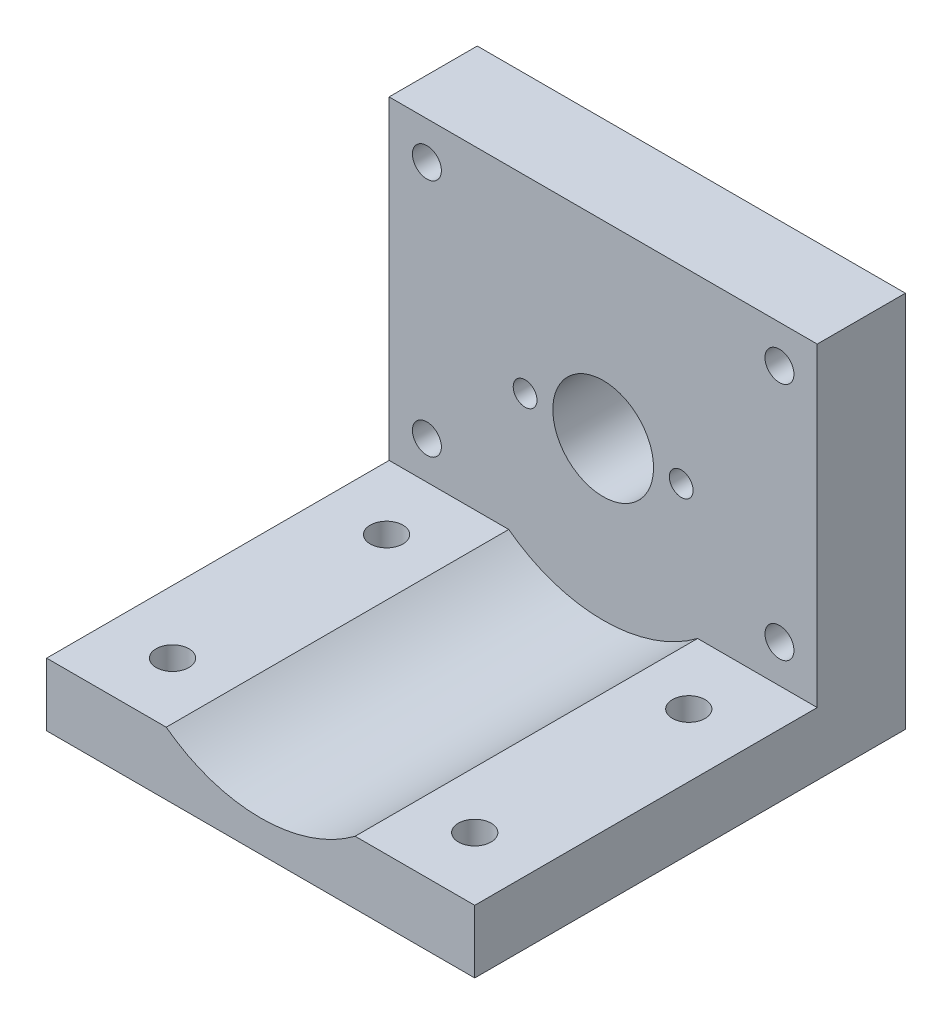
from build123d import *

# Parameters (mm, degrees)
SKETCH2_W                                       = 43.18
SKETCH2_H                                       = 38.1
SKETCH2_R                                       = 5.08
SKETCH2_R_2                                     = 1.4605
BOSS_EXTRUDE1_DEPTH                             = 8.89
CSK_FOR_M2_FLAT_HEAD_MACHINE_SCREW4_D           = 2.4
CSK_FOR_M2_FLAT_HEAD_MACHINE_SCREW4_CSINK_D     = 4.4
CSK_FOR_M2_FLAT_HEAD_MACHINE_SCREW4_CSINK_ANGLE = 90
BOSS_EXTRUDE4_DEPTH                             = 34.544
SKETCH17_R                                      = 1.651
CUT_EXTRUDE1_DEPTH                              = 34.544
CUT_EXTRUDE2_DEPTH                              = 1.27


with BuildPart() as part:
    # Sketch2 → Boss-Extrude1 (new body)
    with BuildSketch(Plane.XY):
        Rectangle(SKETCH2_W, SKETCH2_H)
        Circle(SKETCH2_R, mode=Mode.SUBTRACT)
        with Locations((-17.78, 15.24)):
            Circle(SKETCH2_R_2, mode=Mode.SUBTRACT)
        with Locations((17.78, 15.24)):
            Circle(SKETCH2_R_2, mode=Mode.SUBTRACT)
        with Locations((17.78, -8.89)):
            Circle(SKETCH2_R_2, mode=Mode.SUBTRACT)
        with Locations((-17.78, -8.89)):
            Circle(SKETCH2_R_2, mode=Mode.SUBTRACT)
    extrude(amount=BOSS_EXTRUDE1_DEPTH)

    # CSK for M2 Flat Head Machine Screw4 (through all)
    with Locations(Plane(origin=(0, 0, 0), x_dir=(1, 0, 0), z_dir=(0, 0, -1))):
        with Locations((-7.874, 0), (7.874, 0)):
            CounterSinkHole(CSK_FOR_M2_FLAT_HEAD_MACHINE_SCREW4_D / 2, CSK_FOR_M2_FLAT_HEAD_MACHINE_SCREW4_CSINK_D / 2, counter_sink_angle=CSK_FOR_M2_FLAT_HEAD_MACHINE_SCREW4_CSINK_ANGLE)

    # Sketch13 → Boss-Extrude4 (add)
    with BuildSketch(Plane.XY.offset(8.89)):
        with BuildLine():
            Line((-21.59, -12.7), (-21.59, -19.05))
            Line((-21.59, -19.05), (21.59, -19.05))
            Line((21.59, -19.05), (21.59, -12.7))
            Line((21.59, -12.7), (9.525, -12.7))
            ThreePointArc((9.525, -12.7), (0, -15.875), (-9.525, -12.7))
            Line((-9.525, -12.7), (-21.59, -12.7))
        make_face()
    extrude(amount=BOSS_EXTRUDE4_DEPTH)

    # Sketch17 → Cut-Extrude1 (cut)
    with BuildSketch(Plane(origin=(0, 0, 0), x_dir=(1, 0, 0), z_dir=(0, 1, 0))):
        with Locations(Location((-15.24, -15.494, 0), (0, 0, 270))):
            Circle(SKETCH17_R)
        with Locations(Location((15.24, -15.494, 0), (0, 0, 270))):
            Circle(SKETCH17_R)
        with Locations(Location((-15.24, -37.084, 0), (0, 0, 270))):
            Circle(SKETCH17_R)
        with Locations(Location((15.24, -37.084, 0), (0, 0, 270))):
            Circle(SKETCH17_R)
    extrude(amount=-CUT_EXTRUDE1_DEPTH, mode=Mode.SUBTRACT)

    # Sketch18 → Cut-Extrude2 (cut)
    # profile 1 of 7: a face of its own
    with BuildSketch(Plane(origin=(0, 0, 0), x_dir=(-1, 0, 0), z_dir=(0, 0, -1))):
        Polygon((-9.576939513, 11.26967481), (-7.867324128, 11.26967481), (-7.867324128, 10.699803015), (-9.007067718, 10.699803015), (-9.007067718, 10.089226092), (-7.867324128, 10.089226092), (-7.867324128, 9.519354297), (-9.007067718, 9.519354297), (-9.007067718, 8.664546605), (-7.867324128, 8.664546605), (-7.867324128, 8.09467481), (-9.576939513, 8.09467481), align=None)
    # profile 2 of 7: a face of its own
    with BuildSketch(Plane(origin=(0, 0, 0), x_dir=(-1, 0, 0), z_dir=(0, 0, -1))):
        Polygon((-7.643445923, 10.414867118), (-7.063397846, 10.414867118), (-6.462997205, 9.045521164), (-5.864504617, 10.414867118), (-5.282548487, 10.414867118), (-6.298268639, 8.09467481), (-6.627089753, 8.09467481), align=None)
    # profile 3 of 7: a face of its own
    with BuildSketch(Plane(origin=(0, 0, 0), x_dir=(-1, 0, 0), z_dir=(0, 0, -1))):
        with BuildLine():
            Line((-3.186234385, 10.414867118), (-2.61636259, 10.414867118))
            Line((-2.61636259, 10.414867118), (-2.61636259, 8.09467481))
            Line((-2.61636259, 8.09467481), (-3.186234385, 8.09467481))
            Line((-3.186234385, 8.09467481), (-3.186234385, 8.347809826))
            add(Edge.make_bspline(
                [(-3.186234385, 8.347809826), (-3.214471322, 8.323169934), (-3.269273641, 8.275348769), (-3.355624364, 8.213299592), (-3.442227413, 8.16211704), (-3.529498919, 8.121352929), (-3.618780208, 8.091252828), (-3.71071407, 8.069459652), (-3.80662445, 8.056607683), (-3.871823005, 8.054858175), (-3.904934304, 8.053969682)],
                knots=[0, 0, 0, 0, 1.129196829, 2.191548051, 3.199897424, 4.157751732, 5.089409408, 6.034969131, 7.002052659, 8, 8, 8, 8], degree=3))
            add(Edge.make_bspline(
                [(-3.904934304, 8.053969682), (-3.94210321, 8.054805866), (-4.015551072, 8.056458213), (-4.123327657, 8.073851834), (-4.227396665, 8.100476646), (-4.32767362, 8.138154084), (-4.423976078, 8.186976656), (-4.517041044, 8.245670515), (-4.605273102, 8.316296165), (-4.689406753, 8.395797814), (-4.766439019, 8.483250194), (-4.833781353, 8.577439478), (-4.890545936, 8.677029798), (-4.937050121, 8.781690967), (-4.973631668, 8.891346169), (-4.999709077, 9.006343198), (-5.015094778, 9.126723124), (-5.016999094, 9.208721215), (-5.017965154, 9.250318841)],
                knots=[0, 0, 0, 0, 0.980476535, 1.937477201, 2.874147792, 3.812856188, 4.758993464, 5.720109578, 6.712210464, 7.737600662, 8.772720504, 9.783789959, 10.789002326, 11.793715968, 12.802552247, 13.835794126, 14.902098527, 16, 16, 16, 16], degree=3))
            add(Edge.make_bspline(
                [(-5.017965154, 9.250318841), (-5.016951271, 9.293393237), (-5.014962426, 9.377888463), (-5.000414147, 9.501881191), (-4.974817965, 9.619729562), (-4.93991573, 9.731596812), (-4.895020066, 9.837502268), (-4.840340147, 9.937619437), (-4.775132104, 10.03168663), (-4.699991394, 10.118102755), (-4.618857883, 10.197307308), (-4.532059369, 10.266261152), (-4.440953191, 10.324840651), (-4.345442533, 10.372664255), (-4.245541035, 10.409619916), (-4.141643106, 10.436637522), (-4.033287512, 10.452849035), (-3.959474803, 10.45465697), (-3.92210678, 10.455572246)],
                knots=[0, 0, 0, 0, 1.136281865, 2.228943489, 3.287578264, 4.313574083, 5.316051562, 6.317280042, 7.318008486, 8.329309503, 9.333984563, 10.305318864, 11.248632312, 12.186624717, 13.117503092, 14.05354244, 15.014596925, 16, 16, 16, 16], degree=3))
            add(Edge.make_bspline(
                [(-3.92210678, 10.455572246), (-3.887491883, 10.454853114), (-3.819001479, 10.453430212), (-3.718330454, 10.437980214), (-3.620694078, 10.41461319), (-3.526624965, 10.381319386), (-3.435351527, 10.339279185), (-3.348443726, 10.286599679), (-3.264000374, 10.225494966), (-3.212476653, 10.17777089), (-3.186234385, 10.153463873)],
                knots=[0, 0, 0, 0, 1.017011718, 2.012299608, 2.98747302, 3.965332399, 4.941441765, 5.936729654, 6.94912688, 8, 8, 8, 8], degree=3))
            Line((-3.186234385, 10.153463873), (-3.186234385, 10.414867118))
        make_face()
        with BuildLine():
            add(Edge.make_bspline(
                [(-3.802535466, 9.92640558), (-3.825243177, 9.925708829), (-3.869748809, 9.924343242), (-3.93520043, 9.916129145), (-3.997752545, 9.901655539), (-4.056959038, 9.880273895), (-4.113702302, 9.854227937), (-4.167120682, 9.821605803), (-4.217655056, 9.783047134), (-4.265008227, 9.739485435), (-4.308177619, 9.691603163), (-4.345392154, 9.63935323), (-4.377018497, 9.584143475), (-4.403766164, 9.5258079), (-4.422911424, 9.463656217), (-4.438074463, 9.398497528), (-4.445943098, 9.329799522), (-4.447369434, 9.282983957), (-4.448093359, 9.259223088)],
                knots=[0, 0, 0, 0, 1.04836806, 2.054732945, 3.03993516, 4.00574415, 4.955904794, 5.917688631, 6.888591924, 7.88601754, 8.884115178, 9.859153345, 10.841239365, 11.818093293, 12.814750328, 13.83810466, 14.90274714, 16, 16, 16, 16], degree=3))
            add(Edge.make_bspline(
                [(-4.448093359, 9.259223088), (-4.447380492, 9.235246693), (-4.445975795, 9.188001487), (-4.437947235, 9.118723988), (-4.423329825, 9.052613484), (-4.402003575, 8.990204434), (-4.375959277, 8.930654732), (-4.34425751, 8.874239207), (-4.305317441, 8.821955355), (-4.262110207, 8.772565965), (-4.213785593, 8.728463156), (-4.162965275, 8.689303911), (-4.108955086, 8.656539396), (-4.052341, 8.630058907), (-3.993313582, 8.608479535), (-3.931132806, 8.594187833), (-3.866407812, 8.585051419), (-3.822283075, 8.583779113), (-3.799991396, 8.583136349)],
                knots=[0, 0, 0, 0, 1.099136573, 2.165835871, 3.191374663, 4.196217796, 5.183857741, 6.167377911, 7.154730987, 8.166690795, 9.170734848, 10.148332609, 11.103258353, 12.059567475, 13.009337315, 13.978056681, 14.978520572, 16, 16, 16, 16], degree=3))
            add(Edge.make_bspline(
                [(-3.799991396, 8.583136349), (-3.776860727, 8.583837006), (-3.731512042, 8.585210675), (-3.66499261, 8.59334981), (-3.601600196, 8.607876484), (-3.541598545, 8.629380543), (-3.484071189, 8.655239543), (-3.42953726, 8.687224215), (-3.378588535, 8.725694402), (-3.330966982, 8.7696499), (-3.287331008, 8.81792316), (-3.249601825, 8.870858268), (-3.216738326, 8.926762214), (-3.190892696, 8.986956772), (-3.170367642, 9.050388817), (-3.155641389, 9.117452023), (-3.147631161, 9.188218692), (-3.14623875, 9.236519701), (-3.145529256, 9.26113114)],
                knots=[0, 0, 0, 0, 1.050008698, 2.058587853, 3.036635738, 3.995319155, 4.947022481, 5.895997462, 6.858296291, 7.838991643, 8.833936038, 9.806048392, 10.784806122, 11.771666913, 12.772873988, 13.80724452, 14.882696879, 16, 16, 16, 16], degree=3))
            add(Edge.make_bspline(
                [(-3.145529256, 9.26113114), (-3.146229934, 9.285319274), (-3.14759856, 9.332565727), (-3.155675935, 9.401854821), (-3.170506736, 9.467601212), (-3.190609351, 9.52992575), (-3.216914782, 9.588685931), (-3.249803147, 9.643230244), (-3.287118462, 9.695448447), (-3.331237549, 9.742417578), (-3.378601126, 9.786054805), (-3.430299135, 9.823361625), (-3.484702807, 9.855513679), (-3.5421464, 9.881911755), (-3.603161816, 9.901262545), (-3.666662564, 9.916245154), (-3.733639387, 9.924338312), (-3.779195338, 9.925705245), (-3.802535466, 9.92640558)],
                knots=[0, 0, 0, 0, 1.106611376, 2.161533483, 3.185006901, 4.184773755, 5.152708835, 6.122342771, 7.094156588, 8.082475533, 9.064254463, 10.03606828, 10.992420271, 11.951521816, 12.920622147, 13.915721683, 14.932141191, 16, 16, 16, 16], degree=3))
        make_face(mode=Mode.SUBTRACT)
    # profile 4 of 7: a face of its own
    with BuildSketch(Plane(origin=(0, 0, 0), x_dir=(-1, 0, 0), z_dir=(0, 0, -1))):
        with BuildLine():
            Line((-2.046490795, 10.414867118), (-1.476619, 10.414867118))
            Line((-1.476619, 10.414867118), (-1.476619, 10.169364314))
            add(Edge.make_bspline(
                [(-1.476619, 10.169364314), (-1.444108097, 10.194651964), (-1.38197344, 10.242981579), (-1.287518034, 10.304602085), (-1.198363826, 10.355035995), (-1.112523472, 10.393398607), (-1.028381884, 10.420998858), (-0.944576328, 10.440827991), (-0.859858771, 10.45352513), (-0.802908008, 10.45489024), (-0.774455538, 10.455572246)],
                knots=[0, 0, 0, 0, 1.276643801, 2.439914479, 3.493451431, 4.44993799, 5.350072675, 6.235028322, 7.118224225, 8, 8, 8, 8], degree=3))
            add(Edge.make_bspline(
                [(-0.774455538, 10.455572246), (-0.745594337, 10.454792855), (-0.688937374, 10.453262843), (-0.605513119, 10.442561655), (-0.525809345, 10.423071401), (-0.448929849, 10.397193616), (-0.375657132, 10.363036423), (-0.30509356, 10.322480299), (-0.238754812, 10.273080195), (-0.197900474, 10.235459448), (-0.177234986, 10.216429618)],
                knots=[0, 0, 0, 0, 1.048836932, 2.058954983, 3.049370783, 4.026390553, 5.001981509, 5.982488534, 6.97947532, 8, 8, 8, 8], degree=3))
            add(Edge.make_bspline(
                [(-0.177234986, 10.216429618), (-0.160660503, 10.19879453), (-0.127390233, 10.163395286), (-0.085523777, 10.102818113), (-0.04959765, 10.036777907), (-0.02016118, 9.964512872), (0.001591185, 9.88562596), (0.018325577, 9.80107001), (0.027715536, 9.710371572), (0.02887477, 9.648062601), (0.029470744, 9.616028977)],
                knots=[0, 0, 0, 0, 0.889584746, 1.785680191, 2.700364693, 3.65222533, 4.649950538, 5.707241244, 6.821271309, 8, 8, 8, 8], degree=3))
            Line((0.029470744, 9.616028977), (0.029470744, 8.09467481))
            Line((0.029470744, 8.09467481), (-0.540401051, 8.09467481))
            Line((-0.540401051, 8.09467481), (-0.540401051, 9.102126733))
            add(Edge.make_bspline(
                [(-0.540401051, 9.102126733), (-0.540521567, 9.13498806), (-0.540752512, 9.197960693), (-0.54252566, 9.288083995), (-0.545987878, 9.369477041), (-0.5491436, 9.442288023), (-0.555339536, 9.506258414), (-0.560927131, 9.561793194), (-0.569500755, 9.60838855), (-0.58065643, 9.658508846), (-0.600136985, 9.712171788), (-0.630379599, 9.768714563), (-0.668746595, 9.816748911), (-0.713670912, 9.856611577), (-0.765102935, 9.888146601), (-0.822421183, 9.910333456), (-0.885318362, 9.924160848), (-0.929144377, 9.925638298), (-0.951904457, 9.92640558)],
                knots=[0, 0, 0, 0, 1.49886392, 2.872294502, 4.110984203, 5.214877267, 6.195405875, 7.042225351, 7.75923308, 8.355011229, 9.382752534, 10.352059385, 11.267231453, 12.171456522, 13.078624015, 14.003401117, 14.963110155, 16, 16, 16, 16], degree=3))
            add(Edge.make_bspline(
                [(-0.951904457, 9.92640558), (-0.981504898, 9.924904533), (-1.039409115, 9.921968195), (-1.123155981, 9.899825525), (-1.200076083, 9.862167361), (-1.269540919, 9.810056035), (-1.330888894, 9.745718145), (-1.381416715, 9.668987831), (-1.422859908, 9.581716975), (-1.440681097, 9.517995074), (-1.44990626, 9.485009346)],
                knots=[0, 0, 0, 0, 0.984188326, 1.925263693, 2.85911992, 3.81709677, 4.80007086, 5.801799564, 6.862098548, 8, 8, 8, 8], degree=3))
            add(Edge.make_bspline(
                [(-1.44990626, 9.485009346), (-1.452199079, 9.474649956), (-1.457312527, 9.451546436), (-1.461517692, 9.412515563), (-1.467367381, 9.366209212), (-1.469559115, 9.311789367), (-1.473370301, 9.249513575), (-1.474779859, 9.179299447), (-1.47619194, 9.101284661), (-1.476471931, 9.046794297), (-1.476619, 9.018172406)],
                knots=[0, 0, 0, 0, 0.543362196, 1.211806945, 2.009705693, 2.934833164, 4.000995085, 5.207458376, 6.533175157, 8, 8, 8, 8], degree=3))
            Line((-1.476619, 9.018172406), (-1.476619, 8.09467481))
            Line((-1.476619, 8.09467481), (-2.046490795, 8.09467481))
            Line((-2.046490795, 8.09467481), (-2.046490795, 10.414867118))
        make_face()
    # profile 5 of 7: a face of its own
    with BuildSketch(Plane(origin=(0, 0, 0), x_dir=(-1, 0, 0), z_dir=(0, 0, -1))):
        Polygon((1.901906641, 11.26967481), (2.471778436, 11.26967481), (2.471778436, 10.048520964), (3.570816897, 10.048520964), (3.570816897, 11.26967481), (4.140688692, 11.26967481), (4.140688692, 8.09467481), (3.570816897, 8.09467481), (3.570816897, 9.478649169), (2.471778436, 9.478649169), (2.471778436, 8.09467481), (1.901906641, 8.09467481), align=None)
    # profile 6 of 7: a face of its own
    with BuildSketch(Plane(origin=(0, 0, 0), x_dir=(-1, 0, 0), z_dir=(0, 0, -1))):
        with BuildLine():
            add(Edge.make_bspline(
                [(5.897369381, 10.455572246), (5.92431182, 10.455092787), (5.977670056, 10.454143241), (6.057140483, 10.446239135), (6.135221583, 10.43334326), (6.212362157, 10.416645353), (6.287845882, 10.393249088), (6.362068662, 10.365188886), (6.435694141, 10.332972492), (6.506894951, 10.294623715), (6.576185464, 10.253030969), (6.641876994, 10.207150757), (6.703424018, 10.157343453), (6.761969058, 10.104763879), (6.814783822, 10.047122891), (6.865243455, 9.987197874), (6.910621748, 9.922841924), (6.95263551, 9.855623245), (6.99004006, 9.785930552), (7.022519032, 9.714248651), (7.050707727, 9.641568594), (7.07277891, 9.56700509), (7.091051815, 9.491541356), (7.102583317, 9.414252643), (7.110781415, 9.335932897), (7.111700682, 9.2832016), (7.112163051, 9.256679017)],
                knots=[0, 0, 0, 0, 1.022364134, 2.024744242, 3.027414945, 4.024939316, 5.017584196, 6.023349371, 7.035562955, 8.064994934, 9.090267829, 10.101425541, 11.102933353, 12.093946398, 13.084502048, 14.067315274, 15.065326281, 16.070028806, 17.074376865, 18.064572984, 19.055292013, 20.030201733, 21.013838017, 21.999348303, 22.993720005, 24, 24, 24, 24], degree=3))
            add(Edge.make_bspline(
                [(7.112163051, 9.256679017), (7.111675097, 9.229949227), (7.110704934, 9.176804344), (7.102879914, 9.097747905), (7.089934678, 9.020095738), (7.073172684, 8.943390382), (7.049863974, 8.868613354), (7.022630235, 8.794662412), (6.989199749, 8.722545536), (6.952239883, 8.651475997), (6.90995599, 8.583545155), (6.864616978, 8.518544513), (6.814368694, 8.458179344), (6.761976727, 8.400577554), (6.704956008, 8.34768698), (6.644216693, 8.298648819), (6.580284616, 8.252863558), (6.512700039, 8.211405405), (6.442328607, 8.174977604), (6.37035712, 8.142134969), (6.29636473, 8.11479113), (6.220504568, 8.092492983), (6.142730627, 8.075228085), (6.063214612, 8.063499835), (5.982127771, 8.055342972), (5.927494651, 8.054430392), (5.899913452, 8.053969682)],
                knots=[0, 0, 0, 0, 1.012026251, 2.012137606, 3.004615893, 3.992048833, 4.982446996, 5.968083444, 6.973977695, 7.990229942, 8.999482246, 10.001782172, 10.988562221, 11.971415814, 12.948383116, 13.930088534, 14.925840678, 15.924049238, 16.929462851, 17.924729459, 18.917889337, 19.913673841, 20.916777188, 21.931792057, 22.95587778, 24, 24, 24, 24], degree=3))
            add(Edge.make_bspline(
                [(5.899913452, 8.053969682), (5.859584115, 8.055153428), (5.780094377, 8.057486608), (5.663024787, 8.073468285), (5.550559556, 8.10097694), (5.442515424, 8.139323398), (5.338752038, 8.188462956), (5.240174963, 8.249280621), (5.145803625, 8.320579067), (5.057272607, 8.401755675), (4.976166201, 8.490813764), (4.905309998, 8.585882731), (4.845147347, 8.685537653), (4.795732377, 8.78989217), (4.757594097, 8.899089379), (4.730051752, 9.012802819), (4.714050536, 9.131352123), (4.711737088, 9.211897939), (4.710560487, 9.252862911)],
                knots=[0, 0, 0, 0, 1.029999031, 2.030143771, 3.011211297, 3.982305373, 4.953580601, 5.938004764, 6.935448627, 7.970290061, 9.001484052, 10.007591832, 10.993831261, 11.969999897, 12.951306496, 13.942897864, 14.953773953, 16, 16, 16, 16], degree=3))
            add(Edge.make_bspline(
                [(4.710560487, 9.252862911), (4.71177812, 9.296604521), (4.714171353, 9.38257778), (4.733174676, 9.508530563), (4.763520932, 9.629124384), (4.807081072, 9.744021903), (4.86272532, 9.853435034), (4.930654335, 9.957133011), (5.011203828, 10.055139325), (5.07288861, 10.114416903), (5.104255399, 10.144559626)],
                knots=[0, 0, 0, 0, 1.043912699, 2.05178951, 3.033892, 4.007821512, 4.978932272, 5.95884105, 6.962068106, 8, 8, 8, 8], degree=3))
            add(Edge.make_bspline(
                [(5.104255399, 10.144559626), (5.133037564, 10.169544553), (5.189818816, 10.218834642), (5.282069663, 10.281351038), (5.37652412, 10.335346132), (5.474314266, 10.379740142), (5.575712713, 10.413212509), (5.680199852, 10.437577398), (5.787753957, 10.452543026), (5.860645223, 10.454557375), (5.897369381, 10.455572246)],
                knots=[0, 0, 0, 0, 1.048115528, 2.067714963, 3.060638214, 4.039924844, 5.017819947, 5.994373833, 6.98952318, 8, 8, 8, 8], degree=3))
        make_face()
        with BuildLine():
            add(Edge.make_bspline(
                [(5.910089734, 9.92640558), (5.888025862, 9.92567225), (5.844592892, 9.924228681), (5.78065842, 9.916481437), (5.720188523, 9.900602795), (5.661982156, 9.880409508), (5.607068995, 9.853403831), (5.553945165, 9.821800966), (5.505372989, 9.782253869), (5.459001902, 9.738873598), (5.416907291, 9.69070097), (5.381038686, 9.638216928), (5.348989293, 9.583429401), (5.324687863, 9.524332551), (5.304576106, 9.462541664), (5.290964711, 9.397058388), (5.28149213, 9.328614208), (5.280788925, 9.281729476), (5.280432282, 9.257951052)],
                knots=[0, 0, 0, 0, 1.030650113, 2.02884584, 2.99876339, 3.944280128, 4.900564847, 5.851248946, 6.823638398, 7.81794922, 8.81432732, 9.802856497, 10.78262424, 11.771747962, 12.779760563, 13.812642396, 14.89064281, 16, 16, 16, 16], degree=3))
            add(Edge.make_bspline(
                [(5.280432282, 9.257951052), (5.280849603, 9.233334082), (5.281665176, 9.185224941), (5.290110605, 9.114979126), (5.304037396, 9.048316313), (5.323823002, 8.985339482), (5.348706742, 8.925596592), (5.379236205, 8.869422843), (5.415733596, 8.817155984), (5.457112779, 8.768860379), (5.502421217, 8.725021924), (5.552066662, 8.687401403), (5.603970148, 8.654714162), (5.659327814, 8.628461263), (5.717353423, 8.608191895), (5.778219228, 8.593268241), (5.84224508, 8.5852281), (5.885900592, 8.583843187), (5.908181681, 8.583136349)],
                knots=[0, 0, 0, 0, 1.141730614, 2.231293227, 3.276944405, 4.297399982, 5.28939179, 6.275415646, 7.257752684, 8.24146775, 9.222424823, 10.176631434, 11.126518621, 12.063689483, 13.012557477, 13.974037417, 14.965980454, 16, 16, 16, 16], degree=3))
            add(Edge.make_bspline(
                [(5.908181681, 8.583136349), (5.930473914, 8.583763282), (5.974179632, 8.584992436), (6.03828067, 8.594196854), (6.099457301, 8.608682794), (6.157978494, 8.629126614), (6.213371099, 8.655941442), (6.265847165, 8.688785062), (6.31586833, 8.726928851), (6.361784812, 8.771594455), (6.404288821, 8.820040676), (6.441562295, 8.872583448), (6.472709415, 8.928757212), (6.498255631, 8.988208522), (6.518080023, 9.050855663), (6.531776254, 9.116931487), (6.541253899, 9.186231219), (6.5419412, 9.233749194), (6.542291256, 9.257951052)],
                knots=[0, 0, 0, 0, 1.031504075, 2.022346795, 2.991027682, 3.937587355, 4.885570121, 5.833146507, 6.798790848, 7.791235734, 8.792807298, 9.778388351, 10.766749885, 11.760164525, 12.768777521, 13.802286646, 14.880660483, 16, 16, 16, 16], degree=3))
            add(Edge.make_bspline(
                [(6.542291256, 9.257951052), (6.541868627, 9.282144452), (6.541039291, 9.32961975), (6.53259326, 9.399013209), (6.518803142, 9.464875457), (6.498762346, 9.526925268), (6.474026511, 9.585870532), (6.443475946, 9.641409529), (6.406798562, 9.693268716), (6.365218223, 9.741190947), (6.319230583, 9.784414249), (6.270447103, 9.822958941), (6.217752256, 9.854838363), (6.162134627, 9.881118387), (6.103446245, 9.901337113), (6.041752998, 9.916345344), (5.976865815, 9.924271077), (5.932581058, 9.925686643), (5.910089734, 9.92640558)],
                knots=[0, 0, 0, 0, 1.123894411, 2.205445421, 3.243160173, 4.246488011, 5.231014757, 6.210004299, 7.185865357, 8.177612767, 9.153374344, 10.115157457, 11.061423229, 12.009021698, 12.96873347, 13.94135618, 14.954456845, 16, 16, 16, 16], degree=3))
        make_face(mode=Mode.SUBTRACT)
    # profile 7 of 7: a face of its own
    with BuildSketch(Plane(origin=(0, 0, 0), x_dir=(-1, 0, 0), z_dir=(0, 0, -1))):
        with BuildLine():
            Line((7.60062459, 10.414867118), (8.170496385, 10.414867118))
            Line((8.170496385, 10.414867118), (8.170496385, 9.301200251))
            add(Edge.make_bspline(
                [(8.170496385, 9.301200251), (8.17054699, 9.275120861), (8.170644113, 9.225068143), (8.173346734, 9.153182641), (8.177139046, 9.087446641), (8.181871594, 9.027782629), (8.188935226, 8.974334115), (8.197089892, 8.927203136), (8.206334652, 8.886050106), (8.221367799, 8.840179568), (8.244887429, 8.789983085), (8.280406234, 8.736693625), (8.323429866, 8.690613823), (8.373377048, 8.651334746), (8.430757862, 8.62038197), (8.494781752, 8.599405747), (8.564643166, 8.585307543), (8.613301537, 8.583879154), (8.638605359, 8.583136349)],
                knots=[0, 0, 0, 0, 1.267339619, 2.432334223, 3.495366327, 4.467371443, 5.340232306, 6.114347373, 6.791623365, 7.387877112, 8.457231658, 9.474542289, 10.487879852, 11.508108106, 12.54995813, 13.638205937, 14.771795776, 16, 16, 16, 16], degree=3))
            add(Edge.make_bspline(
                [(8.638605359, 8.583136349), (8.663886726, 8.583984156), (8.712670935, 8.585620128), (8.782997165, 8.598377874), (8.847171856, 8.620238696), (8.905854124, 8.649890322), (8.957313425, 8.689573972), (9.002116934, 8.736859856), (9.039840438, 8.792510754), (9.057968321, 8.83402473), (9.06728124, 8.855351894)],
                knots=[0, 0, 0, 0, 1.116871431, 2.155171802, 3.144773418, 4.104381479, 5.046960687, 6.001340237, 6.973219418, 8, 8, 8, 8], degree=3))
            add(Edge.make_bspline(
                [(9.06728124, 8.855351894), (9.070698769, 8.864825611), (9.07824257, 8.88573775), (9.084956701, 8.921814066), (9.092183106, 8.96436024), (9.097899449, 9.014243327), (9.101133958, 9.071154396), (9.104599403, 9.135165175), (9.106365456, 9.206211913), (9.10659448, 9.256042321), (9.106714333, 9.282119722)],
                knots=[0, 0, 0, 0, 0.56094539, 1.238222264, 2.041156151, 2.969685991, 4.036367568, 5.220421584, 6.545382566, 8, 8, 8, 8], degree=3))
            Line((9.106714333, 9.282119722), (9.106714333, 10.414867118))
            Line((9.106714333, 10.414867118), (9.676586128, 10.414867118))
            Line((9.676586128, 10.414867118), (9.676586128, 9.439852094))
            add(Edge.make_bspline(
                [(9.676586128, 9.439852094), (9.676487455, 9.391508781), (9.67629827, 9.298820019), (9.670876329, 9.165861002), (9.663393436, 9.044974718), (9.65375691, 8.935828328), (9.639871866, 8.838376536), (9.622827235, 8.75284787), (9.603970432, 8.678677144), (9.58667804, 8.634730477), (9.578639413, 8.614301213)],
                knots=[0, 0, 0, 0, 1.388070971, 2.661352173, 3.82033814, 4.865898334, 5.806910977, 6.645039373, 7.370126333, 8, 8, 8, 8], degree=3))
            add(Edge.make_bspline(
                [(9.578639413, 8.614301213), (9.568335965, 8.592313012), (9.547997843, 8.548910194), (9.51270742, 8.487200999), (9.474662367, 8.428736426), (9.432052487, 8.374892673), (9.385747578, 8.325122505), (9.337056536, 8.278294525), (9.283786568, 8.236315639), (9.227319161, 8.198105612), (9.166866392, 8.164186893), (9.102842318, 8.134129163), (9.034555057, 8.109667325), (8.962596739, 8.088932467), (8.886635685, 8.073469417), (8.80682491, 8.061757336), (8.723076879, 8.055704488), (8.665962273, 8.054557426), (8.636697306, 8.053969682)],
                knots=[0, 0, 0, 0, 0.997311338, 1.968606903, 2.91805772, 3.860812155, 4.785445165, 5.709667791, 6.633356648, 7.568312411, 8.508286151, 9.478643871, 10.470653671, 11.485274776, 12.552984541, 13.653035246, 14.797438149, 16, 16, 16, 16], degree=3))
            add(Edge.make_bspline(
                [(8.636697306, 8.053969682), (8.605082918, 8.054346442), (8.543224281, 8.055083634), (8.452849677, 8.064111344), (8.366721465, 8.075792026), (8.285801259, 8.095651328), (8.208958973, 8.118659322), (8.137076799, 8.148023642), (8.069861009, 8.182547763), (8.007179346, 8.222027006), (7.949517946, 8.266823157), (7.895594645, 8.314999857), (7.847150317, 8.368473906), (7.802603452, 8.425594003), (7.762451219, 8.486885852), (7.726673689, 8.552131519), (7.695240556, 8.621627774), (7.67846942, 8.670334725), (7.669950511, 8.695075451)],
                knots=[0, 0, 0, 0, 1.211240017, 2.369985978, 3.478996442, 4.539426614, 5.559871561, 6.551301256, 7.510778031, 8.453136967, 9.386094087, 10.30661716, 11.221130616, 12.147659962, 13.080758632, 14.026335491, 14.997475882, 16, 16, 16, 16], degree=3))
            add(Edge.make_bspline(
                [(7.669950511, 8.695075451), (7.664138634, 8.714290046), (7.651618495, 8.755682763), (7.638100581, 8.824472628), (7.627288462, 8.903756798), (7.616770775, 8.993613261), (7.609433444, 9.094192662), (7.604637677, 9.205335267), (7.601397325, 9.327258416), (7.600889757, 9.41207708), (7.60062459, 9.456388552)],
                knots=[0, 0, 0, 0, 0.627914866, 1.352675004, 2.190563461, 3.132055958, 4.183353232, 5.345633452, 6.613289997, 8, 8, 8, 8], degree=3))
            Line((7.60062459, 9.456388552), (7.60062459, 10.414867118))
        make_face()
    extrude(amount=-CUT_EXTRUDE2_DEPTH, mode=Mode.SUBTRACT)


solid = part.part
